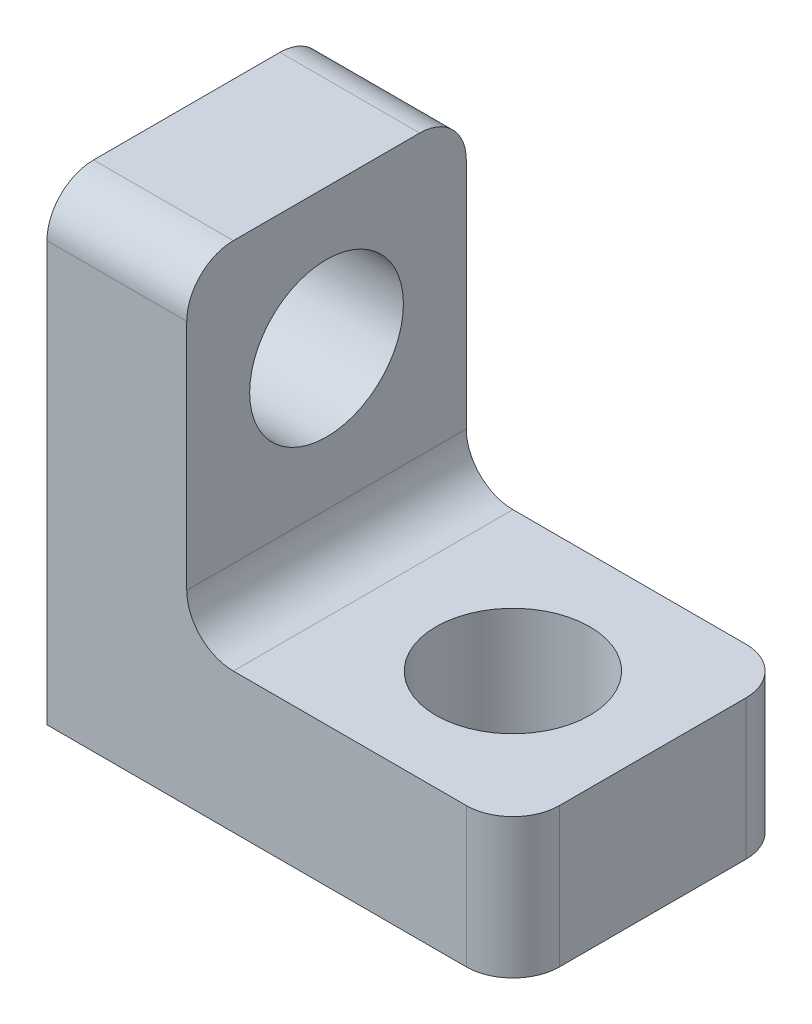
from build123d import *

# Parameters (mm, degrees)
EXTRUDE_1_DEPTH     = 6
SKETCH_2_R          = 1.65
CUT_EXTRUDE_1_DEPTH = 6
SKETCH_3_R          = 1.65
CUT_EXTRUDE_2_DEPTH = 6
FILLET_1_R          = 1


with BuildPart() as part:
    # 草图1 → 凸台-拉伸1 (new body)
    with BuildSketch(Plane.XY):
        Polygon((10, 0), (0, 0), (0, 10), (3, 10), (3, 3), (10, 3), align=None)
    extrude(amount=EXTRUDE_1_DEPTH)

    # 草图2 → 切除-拉伸1 (cut)
    with BuildSketch(Plane(origin=(3, 0, 0), x_dir=(0, 0, -1), z_dir=(1, 0, 0))):
        with Locations(Location((-3, 7, 0), (0, 0, 90))):
            Circle(SKETCH_2_R)
    extrude(amount=-CUT_EXTRUDE_1_DEPTH, mode=Mode.SUBTRACT)

    # 草图3 → 切除-拉伸2 (cut)
    with BuildSketch(Plane(origin=(0, 3, 0), x_dir=(1, 0, 0), z_dir=(0, 1, 0))):
        with Locations(Location((7, -3, 0), (0, 0, 270))):
            Circle(SKETCH_3_R)
    extrude(amount=-CUT_EXTRUDE_2_DEPTH, mode=Mode.SUBTRACT)

    # 圆角1
    fillet_1_edges = [part.edges().sort_by_distance(p)[0] for p in [
        (3, 3, 3),
        (1.5, 10, 6),
        (10, 1.5, 6),
        (1.5, 10, 0),
        (10, 1.5, 0),
    ]]
    fillet(fillet_1_edges, radius=FILLET_1_R)


solid = part.part
